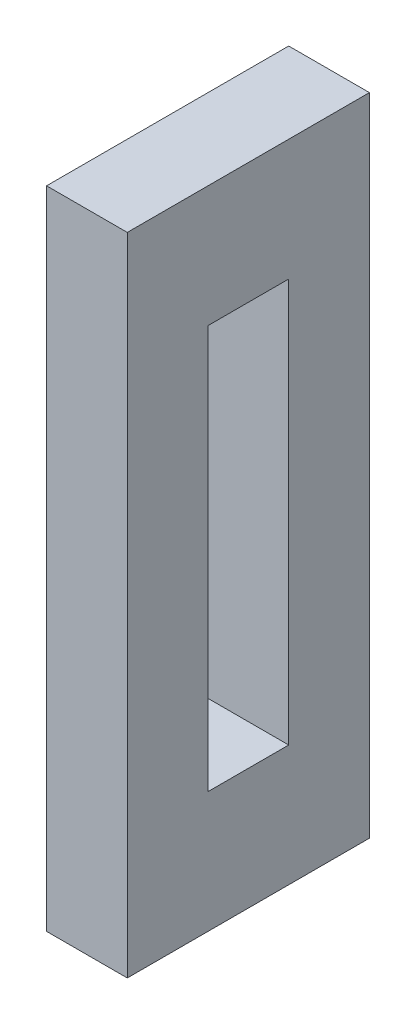
from build123d import *

# Parameters (mm, degrees)
SKETCH1_W           = 80
SKETCH1_H           = 30
SKETCH1_W_2         = 50
SKETCH1_H_2         = 10
BOSS_EXTRUDE1_DEPTH = 10


with BuildPart() as part:
    # Sketch1 → Boss-Extrude1 (new body)
    with BuildSketch(Plane(origin=(0, 0, 0), x_dir=(0, -1, 0), z_dir=(1, 0, 0))):
        Rectangle(SKETCH1_W, SKETCH1_H)
        Rectangle(SKETCH1_W_2, SKETCH1_H_2, mode=Mode.SUBTRACT)
    extrude(amount=BOSS_EXTRUDE1_DEPTH)


solid = part.part
